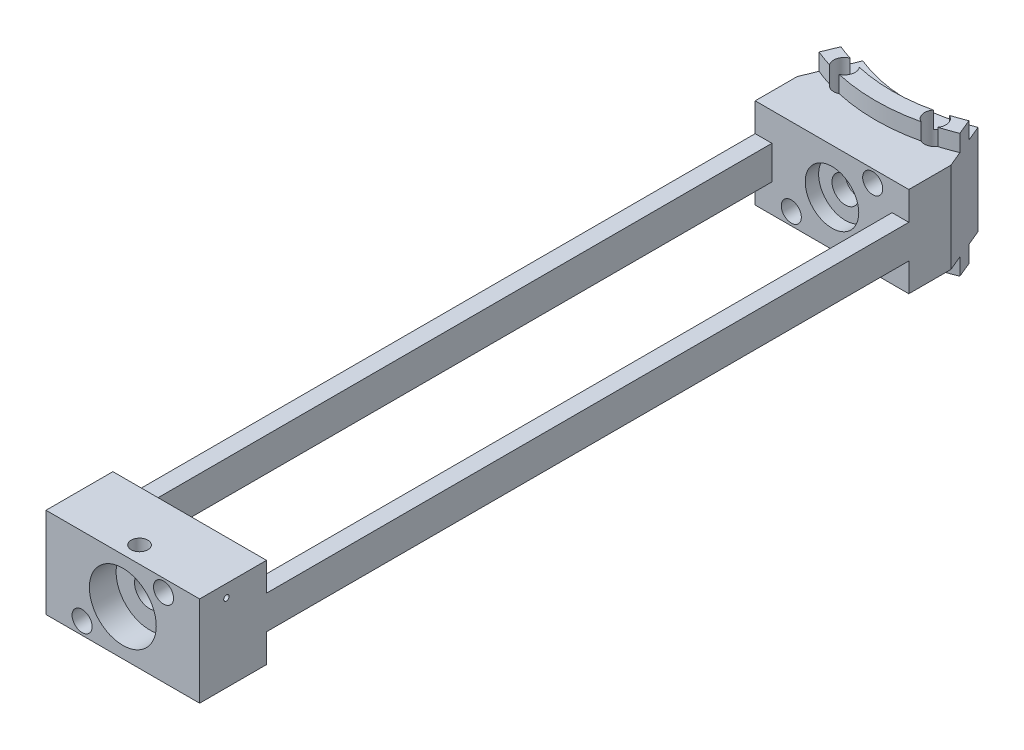
from build123d import *

# Parameters (mm, degrees)
BOSS_EXTRUDE1_DEPTH      = 13.5
BOSS_EXTRUDE2_DEPTH      = 18.5
BOSS_EXTRUDE3_DEPTH      = 5
SKETCH4_W                = 45.922011884
SKETCH4_H                = 20
BOSS_EXTRUDE4_DEPTH      = 13.5
SKETCH2_R                = 4
CUT_EXTRUDE1_DEPTH       = 282.548322307
SKETCH5_R                = 8
CUT_EXTRUDE2_DEPTH       = 4
SKETCH6_R                = 10
CUT_EXTRUDE3_DEPTH       = 8
BOSS_EXTRUDE5_DEPTH      = 13.5
CUT_EXTRUDE5_REACH       = 223.967
CUT_EXTRUDE5_END_RADIUS  = 45
SKETCH8_R                = 9
CUT_EXTRUDE6_REACH       = 223.967
SKETCH10_R               = 4
CUT_EXTRUDE7_START       = -4
SKETCH11_R               = 8
CUT_EXTRUDE7_DEPTH       = 4
SKETCH15_R               = 3
CUT_EXTRUDE8_DEPTH       = 224.567228
M6_CLEARANCE_HOLE1_D     = 6.4
CUT_EXTRUDE9_REACH       = 234.304
SKETCH20_R               = 4.5
CIRPATTERN1_COUNT        = 2
CUT_EXTRUDE10_REACH      = 284.756
CUT_EXTRUDE10_END_RADIUS = 10
SKETCH21_R               = 2.5
SKETCH22_R               = 11
CUT_EXTRUDE11_DEPTH      = 47


with BuildPart() as part:
    # Sketch1 → Boss-Extrude1 (new, symmetric)
    with BuildSketch(Plane(origin=(0, 0, 0), x_dir=(1, 0, 0), z_dir=(0, 1, 0))):
        with BuildLine():
            ThreePointArc((17.220754456, -41.574578963), (0, -45), (-17.220754456, -41.574578963))
            Line((-17.220754456, -41.574578963), (-22.961005942, -55.432771951))
            ThreePointArc((-22.961005942, -55.432771951), (0, -60), (22.961005942, -55.432771951))
            Line((22.961005942, -55.432771951), (17.220754456, -41.574578963))
        make_face()
    extrude(amount=BOSS_EXTRUDE1_DEPTH, both=True)

    # Sketch1<3> → Boss-Extrude2 (add, symmetric)
    with BuildSketch(Plane(origin=(0, 0, 0), x_dir=(1, 0, 0), z_dir=(0, 1, 0))):
        with BuildLine():
            ThreePointArc((19.134171618, -46.193976626), (0, -50), (-19.134171618, -46.193976626))
            Line((-19.134171618, -46.193976626), (-21.04758878, -50.813374288))
            ThreePointArc((-21.04758878, -50.813374288), (0, -55), (21.04758878, -50.813374288))
            Line((21.04758878, -50.813374288), (19.134171618, -46.193976626))
        make_face()
    extrude(amount=BOSS_EXTRUDE2_DEPTH, both=True)

    # Sketch3 → Boss-Extrude3 (add, symmetric)
    with BuildSketch(Plane.XZ):
        with BuildLine():
            Line((-22.961005942, 280), (-22.961005942, 55.432771951))
            ThreePointArc((-22.961005942, 55.432771951), (-20.481139434, 56.39612511), (-17.961005942, 57.248600555))
            Line((-17.961005942, 57.248600555), (-17.961005942, 260))
            Line((-17.961005942, 260), (17.961005942, 260))
            Line((17.961005942, 260), (17.961005942, 57.248600555))
            ThreePointArc((17.961005942, 57.248600555), (20.481139434, 56.39612511), (22.961005942, 55.432771951))
            Line((22.961005942, 55.432771951), (22.961005942, 280))
            Line((22.961005942, 280), (-22.961005942, 280))
        make_face()
    extrude(amount=BOSS_EXTRUDE3_DEPTH, both=True)

    # Sketch4 → Boss-Extrude4 (add, symmetric)
    with BuildSketch(Plane(origin=(0, 0, 0), x_dir=(1, 0, 0), z_dir=(0, 1, 0))):
        with Locations((0, -270)):
            Rectangle(SKETCH4_W, SKETCH4_H)
    extrude(amount=BOSS_EXTRUDE4_DEPTH, both=True)

    # Sketch2 → Cut-Extrude1 (cut, through all)
    with BuildSketch(Plane.XY):
        with Locations(Location((0, 0, 0), (0, 0, 180))):
            Circle(SKETCH2_R)
    extrude(amount=CUT_EXTRUDE1_DEPTH, mode=Mode.SUBTRACT)

    # Sketch5 → Cut-Extrude2 (cut)
    with BuildSketch(Plane(origin=(0, 0, 260), x_dir=(-1, 0, 0), z_dir=(0, 0, -1))):
        Circle(SKETCH5_R)
    extrude(amount=-CUT_EXTRUDE2_DEPTH, mode=Mode.SUBTRACT)

    # Sketch6 → Cut-Extrude3 (cut)
    with BuildSketch(Plane.XY.offset(280)):
        Circle(SKETCH6_R)
    extrude(amount=-CUT_EXTRUDE3_DEPTH, mode=Mode.SUBTRACT)

    # Sketch9 → Boss-Extrude5 (add, symmetric)
    with BuildSketch(Plane(origin=(0, 0, 0), x_dir=(1, 0, 0), z_dir=(0, 1, 0))):
        with BuildLine():
            Line((-22.961005942, -55.432771951), (-22.961005942, -68))
            Line((-22.961005942, -68), (22.961005942, -68))
            Line((22.961005942, -68), (22.961005942, -55.432771951))
            ThreePointArc((22.961005942, -55.432771951), (0, -60), (-22.961005942, -55.432771951))
        make_face()
    extrude(amount=BOSS_EXTRUDE5_DEPTH, both=True)

    # Cut-Extrude5: up to this cylinder (the profile starts outside it)
    cut_extrude5_end = Plane(origin=(0, 0, 0), z_dir=(0, -1, 0)) * Cylinder(CUT_EXTRUDE5_END_RADIUS, 538.934, mode=Mode.PRIVATE)
    # Sketch8 → Cut-Extrude5 (cut, up to the surface)
    with BuildSketch(Plane.XY.offset(60), mode=Mode.PRIVATE) as cut_extrude5_sk1:
        Circle(SKETCH8_R)
    cut_extrude5_tool1 = extrude(cut_extrude5_sk1.sketch, amount=-CUT_EXTRUDE5_REACH, mode=Mode.PRIVATE) - cut_extrude5_end
    add(cut_extrude5_tool1.solids().sort_by_distance((0, 0, 60))[0], mode=Mode.SUBTRACT)

    # Sketch10 → Cut-Extrude6 (cut, up to next)
    with BuildSketch(Plane.XY.offset(60), mode=Mode.PRIVATE) as cut_extrude6_sk1:
        with Locations(Location((0, 0, 0), (0, 0, 180))):
            Circle(SKETCH10_R)
    cut_extrude6_tool1 = extrude(cut_extrude6_sk1.sketch, amount=CUT_EXTRUDE6_REACH, mode=Mode.PRIVATE) & part.part
    add(cut_extrude6_tool1.solids().sort_by_distance((0, 0, 60))[0], mode=Mode.SUBTRACT)

    # Sketch11 → Cut-Extrude7 (cut)
    with BuildSketch(Plane.XY.offset(68).offset(CUT_EXTRUDE7_START)):
        with Locations(Location((0, 0, 0), (0, 0, 180))):
            Circle(SKETCH11_R)
    extrude(amount=CUT_EXTRUDE7_DEPTH, mode=Mode.SUBTRACT)

    # Sketch15 → Cut-Extrude8 (cut)
    with BuildSketch(Plane.XY.offset(280)):
        with Locations((-12.167449647, -9.762846361)):
            Circle(SKETCH15_R)
        with Locations((12.167449647, 9.762846361)):
            Circle(SKETCH15_R)
    extrude(amount=-CUT_EXTRUDE8_DEPTH, mode=Mode.SUBTRACT)

    # Sketch17 → M2 Tapped Hole1 (revolve, cut)
    with BuildSketch(Plane(origin=(22.961005942, 9.762846361, 272), x_dir=(0, 0, -1), z_dir=(0, 1, 0))):
        Polygon((0, 0), (0, 10.480688495), (0.8, 10), (0.8, 0), align=None)
    m2_tapped_hole1 = revolve(axis=Axis((29.311005942, 9.762846361, 272), (-1, 0, 0)), mode=Mode.SUBTRACT)

    # M6 Clearance Hole1 (through all)
    with Locations(Plane(origin=(0, 18.5, 0), x_dir=(1, 0, 0), z_dir=(0, 1, 0))):
        with Locations((13.587999868, -50.71110588), (-13.587999868, -50.71110588)):
            Hole(M6_CLEARANCE_HOLE1_D / 2)

    # Sketch20 → Cut-Extrude9 (cut, up to next)
    with BuildSketch(Plane.XY.offset(272), mode=Mode.PRIVATE) as cut_extrude9_sk1:
        Circle(SKETCH20_R)
    cut_extrude9_tool1 = extrude(cut_extrude9_sk1.sketch, amount=-CUT_EXTRUDE9_REACH, mode=Mode.PRIVATE) & part.part
    add(cut_extrude9_tool1.solids().sort_by_distance((0, 0, 272))[0], mode=Mode.SUBTRACT)

    # CirPattern1: M2 Tapped Hole1 ×2 about axis
    cirpattern1_axis = Axis((0, 0, 68), (0, 0, 1))
    for i in range(1, CIRPATTERN1_COUNT):
        add(m2_tapped_hole1.rotate(cirpattern1_axis, i * 360 / CIRPATTERN1_COUNT), mode=Mode.SUBTRACT)

    # Cut-Extrude10: up to this cylinder (the profile starts outside it)
    cut_extrude10_end = Plane(origin=(0, 0, 275), z_dir=(0, 0, 1)) * Cylinder(CUT_EXTRUDE10_END_RADIUS, 590.512, mode=Mode.PRIVATE)
    # Sketch21 → Cut-Extrude10 (cut, up to the surface)
    with BuildSketch(Plane(origin=(0, 13.5, 0), x_dir=(1, 0, 0), z_dir=(0, 1, 0)), mode=Mode.PRIVATE) as cut_extrude10_sk1:
        with Locations(Location((0, -275, 0), (0, 0, 270))):
            Circle(SKETCH21_R)
    cut_extrude10_tool1 = extrude(cut_extrude10_sk1.sketch, amount=-CUT_EXTRUDE10_REACH, mode=Mode.PRIVATE) - cut_extrude10_end
    add(cut_extrude10_tool1.solids().sort_by_distance((0, 13.5, 275))[0], mode=Mode.SUBTRACT)

    # Sketch22 → Cut-Extrude11 (cut)
    with BuildSketch(Plane.XY):
        with Locations(Location((0, 0, 0), (0, 0, 180))):
            Circle(SKETCH22_R)
    extrude(amount=CUT_EXTRUDE11_DEPTH, mode=Mode.SUBTRACT)


solid = part.part
